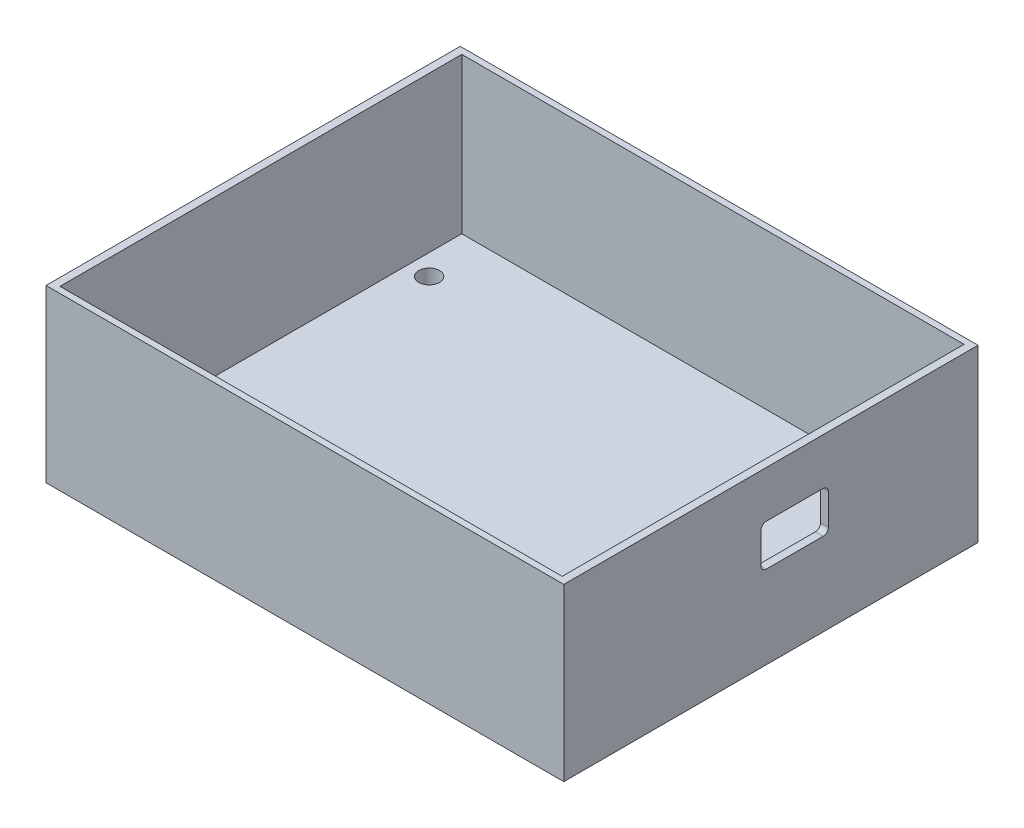
from build123d import *

# Parameters (mm, degrees)
SKETCH1_W           = 100
SKETCH1_H           = 80
BOSS_EXTRUDE1_DEPTH = 3
SKETCH2_W           = 100
SKETCH2_H           = 80
SKETCH2_W_2         = 97
SKETCH2_H_2         = 77.6
BOSS_EXTRUDE2_DEPTH = 30
SKETCH3_R           = 2
CUT_EXTRUDE1_DEPTH  = 40
SKETCH4_W           = 95
SKETCH4_H           = 75
BOSS_EXTRUDE3_DEPTH = 5
SKETCH3_2_R         = 2
CUT_EXTRUDE2_DEPTH  = 12
SKETCH5_W           = 13
SKETCH5_H           = 8
CUT_EXTRUDE3_DEPTH  = 10
FILLET1_R           = 1
FILLET2_R           = 1
FILLET3_R           = 1
FILLET4_R           = 1


with BuildPart() as part:
    # Sketch1 → Boss-Extrude1 (new body)
    with BuildSketch(Plane(origin=(0, 0, 0), x_dir=(1, 0, 0), z_dir=(0, 1, 0))):
        Rectangle(SKETCH1_W, SKETCH1_H)
    extrude(amount=BOSS_EXTRUDE1_DEPTH)

    # Sketch2 → Boss-Extrude2 (add)
    with BuildSketch(Plane(origin=(0, 3, 0), x_dir=(1, 0, 0), z_dir=(0, 1, 0))):
        Rectangle(SKETCH2_W, SKETCH2_H)
        Rectangle(SKETCH2_W_2, SKETCH2_H_2, mode=Mode.SUBTRACT)
    extrude(amount=BOSS_EXTRUDE2_DEPTH)

    # Sketch3 → Cut-Extrude1 (cut)
    with BuildSketch(Plane(origin=(0, 3, 0), x_dir=(1, 0, 0), z_dir=(0, 1, 0))):
        with Locations((-44.5, 28.5)):
            Circle(SKETCH3_R)
        with Locations((44.5, 28.5)):
            Circle(SKETCH3_R)
        with Locations((-44.5, -28.5)):
            Circle(SKETCH3_R)
        with Locations((44.5, -28.5)):
            Circle(SKETCH3_R)
    extrude(amount=-CUT_EXTRUDE1_DEPTH, mode=Mode.SUBTRACT)

    # Sketch4 → Boss-Extrude3 (add)
    with BuildSketch(Plane(origin=(0, 3, 0), x_dir=(1, 0, 0), z_dir=(0, 1, 0))):
        Rectangle(SKETCH4_W, SKETCH4_H)
    extrude(amount=-BOSS_EXTRUDE3_DEPTH)

    # Sketch3<2> → Cut-Extrude2 (cut)
    with BuildSketch(Plane(origin=(0, 3, 0), x_dir=(1, 0, 0), z_dir=(0, 1, 0))):
        with Locations((-44.5, 28.5)):
            Circle(SKETCH3_2_R)
        with Locations((44.5, 28.5)):
            Circle(SKETCH3_2_R)
        with Locations((-44.5, -28.5)):
            Circle(SKETCH3_2_R)
        with Locations((44.5, -28.5)):
            Circle(SKETCH3_2_R)
    extrude(amount=-CUT_EXTRUDE2_DEPTH, mode=Mode.SUBTRACT)

    # Sketch5 → Cut-Extrude3 (cut)
    with BuildSketch(Plane(origin=(50, 0, 0), x_dir=(0, 0, -1), z_dir=(1, 0, 0))):
        with Locations((4.6, 20)):
            Rectangle(SKETCH5_W, SKETCH5_H)
    extrude(amount=-CUT_EXTRUDE3_DEPTH, mode=Mode.SUBTRACT)

    # Fillet1
    fillet1_edges = [part.edges().sort_by_distance(p)[0] for p in [
        (49.25, 24, -11.1),
    ]]
    fillet(fillet1_edges, radius=FILLET1_R)

    # Fillet2
    fillet2_edges = [part.edges().sort_by_distance(p)[0] for p in [
        (49.25, 24, 1.9),
    ]]
    fillet(fillet2_edges, radius=FILLET2_R)

    # Fillet3
    fillet3_edges = [part.edges().sort_by_distance(p)[0] for p in [
        (49.25, 16, 1.9),
    ]]
    fillet(fillet3_edges, radius=FILLET3_R)

    # Fillet4
    fillet4_edges = [part.edges().sort_by_distance(p)[0] for p in [
        (49.25, 16, -11.1),
    ]]
    fillet(fillet4_edges, radius=FILLET4_R)


solid = part.part
